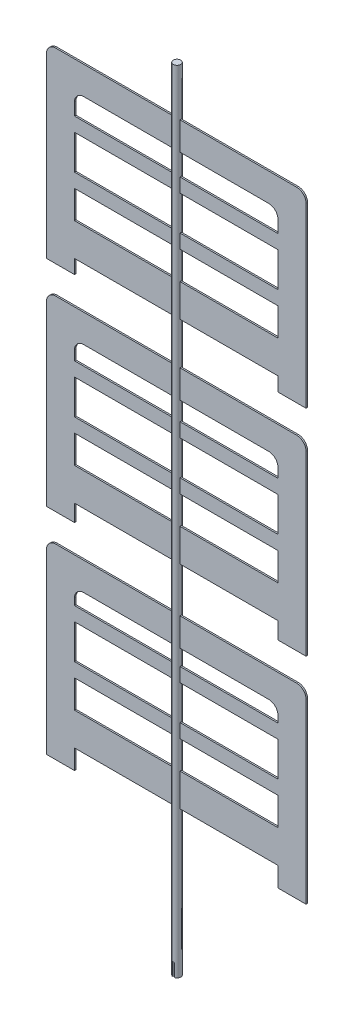
from build123d import *

# Parameters (mm, degrees)
IZIM1_R                       = 20
Y_KSEKLIK_EKSTR_ZYON1_DEPTH   = 2088.7
IZIM2_W                       = 12
IZIM2_H                       = 8
KES_EKSTR_ZYON1_DEPTH         = 64.2
KES_EKSTR_ZYON4_DEPTH         = 3.08
KES_EKSTR_ZYON4_DEPTH_BACK    = 3.08
Y_KSEKLIK_EKSTR_ZYON2_DEPTH   = 4
Y_KSEKLIK_EKSTR_ZYON2_2_DEPTH = 4
Y_KSEKLIK_EKSTR_ZYON2_3_DEPTH = 4
Y_KSEKLIK_EKSTR_ZYON2_4_DEPTH = 4
Y_KSEKLIK_EKSTR_ZYON2_5_DEPTH = 4
Y_KSEKLIK_EKSTR_ZYON2_6_DEPTH = 4
IZIM5_W                       = 40
IZIM5_H                       = 150
Y_KSEKLIK_EKSTR_ZYON3_DEPTH   = 8
IZIM6_W                       = 1090
IZIM6_H                       = 75
IZIM6_H_2                     = 175
Y_KSEKLIK_EKSTR_ZYON4_DEPTH   = 8
Y_KSEKLIK_EKSTR_ZYON5_START   = 55
IZIM7_R                       = 20
Y_KSEKLIK_EKSTR_ZYON5_DEPTH   = 55


with BuildPart() as part:
    # Çizim1 → Yükseklik-Ekstrüzyon1 (new, symmetric)
    with BuildSketch(Plane(origin=(0, 0, 0), x_dir=(1, 0, 0), z_dir=(0, 1, 0))):
        Circle(IZIM1_R)
    extrude(amount=Y_KSEKLIK_EKSTR_ZYON1_DEPTH, both=True)

    # Çizim2 → Kes-Ekstrüzyon1 (cut)
    with BuildSketch(Plane.XZ.offset(2088.7)):
        with Locations((0, 20)):
            Rectangle(IZIM2_W, IZIM2_H)
    extrude(amount=-KES_EKSTR_ZYON1_DEPTH, mode=Mode.SUBTRACT)

    # Çizim3 → Kes-Ekstrüzyon4 (cut, two sides: drawn at the far end of the back side and taken through both)
    with BuildSketch(Plane.XY.offset(19.08).offset(-KES_EKSTR_ZYON4_DEPTH_BACK)):
        with BuildLine():
            Line((6, -2024.5), (6, -2022.1))
            ThreePointArc((6, -2022.1), (0, -2016.1), (-6, -2022.1))
            Line((-6, -2022.1), (-6, -2024.5))
            Line((-6, -2024.5), (6, -2024.5))
        make_face()
    extrude(amount=KES_EKSTR_ZYON4_DEPTH + KES_EKSTR_ZYON4_DEPTH_BACK, mode=Mode.SUBTRACT)



with BuildPart() as body_2:
    # Çizim4 → Yükseklik-Ekstrüzyon2 (new, symmetric)
    with BuildSketch(Plane.XY):
        with BuildLine():
            Line((20, 1888.7), (645, 1888.7))
            ThreePointArc((645, 1888.7), (680.355339059, 1874.055339059), (695, 1838.7))
            Line((695, 1838.7), (695, 888.7))
            Line((695, 888.7), (545, 888.7))
            Line((545, 888.7), (545, 1688.7))
            ThreePointArc((545, 1688.7), (530.355339059, 1724.055339059), (495, 1738.7))
            Line((495, 1738.7), (20, 1738.7))
            Line((20, 1738.7), (20, 1888.7))
        make_face()
    extrude(amount=Y_KSEKLIK_EKSTR_ZYON2_DEPTH, both=True)


with BuildPart() as body_3:
    # Çizim4 → Y_kseklik-Ekstr_zyon2 2 (new, symmetric)
    with BuildSketch(Plane.XY):
        with BuildLine():
            Line((-495, 1738.7), (-20, 1738.7))
            Line((-20, 1738.7), (-20, 1888.7))
            Line((-20, 1888.7), (-645, 1888.7))
            ThreePointArc((-645, 1888.7), (-680.355339059, 1874.055339059), (-695, 1838.7))
            Line((-695, 1838.7), (-695, 888.7))
            Line((-695, 888.7), (-545, 888.7))
            Line((-545, 888.7), (-545, 1688.7))
            ThreePointArc((-545, 1688.7), (-530.355339059, 1724.055339059), (-495, 1738.7))
        make_face()
    extrude(amount=Y_KSEKLIK_EKSTR_ZYON2_2_DEPTH, both=True)


with BuildPart() as body_4:
    # Çizim4 → Y_kseklik-Ekstr_zyon2 3 (new, symmetric)
    with BuildSketch(Plane.XY):
        with BuildLine():
            Line((20, 588.7), (20, 738.7))
            Line((20, 738.7), (645, 738.7))
            ThreePointArc((645, 738.7), (680.355339059, 724.055339059), (695, 688.7))
            Line((695, 688.7), (695, -261.3))
            Line((695, -261.3), (545, -261.3))
            Line((545, -261.3), (545, 538.7))
            ThreePointArc((545, 538.7), (530.355339059, 574.055339059), (495, 588.7))
            Line((495, 588.7), (20, 588.7))
        make_face()
    extrude(amount=Y_KSEKLIK_EKSTR_ZYON2_3_DEPTH, both=True)


with BuildPart() as body_5:
    # Çizim4 → Y_kseklik-Ekstr_zyon2 4 (new, symmetric)
    with BuildSketch(Plane.XY):
        with BuildLine():
            Line((-495, 588.7), (-20, 588.7))
            Line((-20, 588.7), (-20, 738.7))
            Line((-20, 738.7), (-645, 738.7))
            ThreePointArc((-645, 738.7), (-680.355339059, 724.055339059), (-695, 688.7))
            Line((-695, 688.7), (-695, -261.3))
            Line((-695, -261.3), (-545, -261.3))
            Line((-545, -261.3), (-545, 538.7))
            ThreePointArc((-545, 538.7), (-530.355339059, 574.055339059), (-495, 588.7))
        make_face()
    extrude(amount=Y_KSEKLIK_EKSTR_ZYON2_4_DEPTH, both=True)


with BuildPart() as body_6:
    # Çizim4 → Y_kseklik-Ekstr_zyon2 5 (new, symmetric)
    with BuildSketch(Plane.XY):
        with BuildLine():
            Line((20, -561.3), (20, -411.3))
            Line((20, -411.3), (645, -411.3))
            ThreePointArc((645, -411.3), (680.355339059, -425.944660941), (695, -461.3))
            Line((695, -461.3), (695, -1411.3))
            Line((695, -1411.3), (545, -1411.3))
            Line((545, -1411.3), (545, -611.3))
            ThreePointArc((545, -611.3), (530.355339059, -575.944660941), (495, -561.3))
            Line((495, -561.3), (20, -561.3))
        make_face()
    extrude(amount=Y_KSEKLIK_EKSTR_ZYON2_5_DEPTH, both=True)


with BuildPart() as body_7:
    # Çizim4 → Y_kseklik-Ekstr_zyon2 6 (new, symmetric)
    with BuildSketch(Plane.XY):
        with BuildLine():
            Line((-495, -561.3), (-20, -561.3))
            Line((-20, -561.3), (-20, -411.3))
            Line((-20, -411.3), (-645, -411.3))
            ThreePointArc((-645, -411.3), (-680.355339059, -425.944660941), (-695, -461.3))
            Line((-695, -461.3), (-695, -1411.3))
            Line((-695, -1411.3), (-545, -1411.3))
            Line((-545, -1411.3), (-545, -611.3))
            ThreePointArc((-545, -611.3), (-530.355339059, -575.944660941), (-495, -561.3))
        make_face()
    extrude(amount=Y_KSEKLIK_EKSTR_ZYON2_6_DEPTH, both=True)


with BuildPart() as part_1:
    add(part.part)

    add(body_2.part)  # Yükseklik-Ekstrüzyon3 merges body 2

    add(body_3.part)  # Yükseklik-Ekstrüzyon3 merges body 3

    add(body_4.part)  # Yükseklik-Ekstrüzyon3 merges body 4

    add(body_5.part)  # Yükseklik-Ekstrüzyon3 merges body 5

    add(body_6.part)  # Yükseklik-Ekstrüzyon3 merges body 6

    add(body_7.part)  # Yükseklik-Ekstrüzyon3 merges body 7
    # Çizim5 → Yükseklik-Ekstrüzyon3 (add)
    with BuildSketch(Plane(origin=(0, 0, -4), x_dir=(-1, 0, 0), z_dir=(0, 0, -1))):
        with Locations((0, -486.3)):
            Rectangle(IZIM5_W, IZIM5_H)
        with Locations((0, 663.7)):
            Rectangle(IZIM5_W, IZIM5_H)
        with Locations((0, 1813.7)):
            Rectangle(IZIM5_W, IZIM5_H)
    extrude(amount=-Y_KSEKLIK_EKSTR_ZYON3_DEPTH)

    # Çizim6 → Yükseklik-Ekstrüzyon4 (add)
    with BuildSketch(Plane(origin=(0, 0, -4), x_dir=(-1, 0, 0), z_dir=(0, 0, -1))):
        with Locations((0, 451.2)):
            Rectangle(IZIM6_W, IZIM6_H)
        with Locations((0, 191.2)):
            Rectangle(IZIM6_W, IZIM6_H)
        with Locations((0, -83.8)):
            Rectangle(IZIM6_W, IZIM6_H_2)
        with Locations((0, 1051.2)):
            Rectangle(IZIM6_W, IZIM6_H_2)
        with Locations((0, 1326.2)):
            Rectangle(IZIM6_W, IZIM6_H)
        with Locations((0, 1586.2)):
            Rectangle(IZIM6_W, IZIM6_H)
        with Locations((0, -1218.8)):
            Rectangle(IZIM6_W, IZIM6_H_2)
        with Locations((0, -943.8)):
            Rectangle(IZIM6_W, IZIM6_H)
        with Locations((0, -683.8)):
            Rectangle(IZIM6_W, IZIM6_H)
    extrude(amount=-Y_KSEKLIK_EKSTR_ZYON4_DEPTH)

    # Çizim7 → Yükseklik-Ekstrüzyon5 (add)
    with BuildSketch(Plane(origin=(0, 2088.7, 0), x_dir=(1, 0, 0), z_dir=(0, 1, 0)).offset(Y_KSEKLIK_EKSTR_ZYON5_START)):
        Circle(IZIM7_R)
    extrude(amount=-Y_KSEKLIK_EKSTR_ZYON5_DEPTH)


solid = part_1.part
